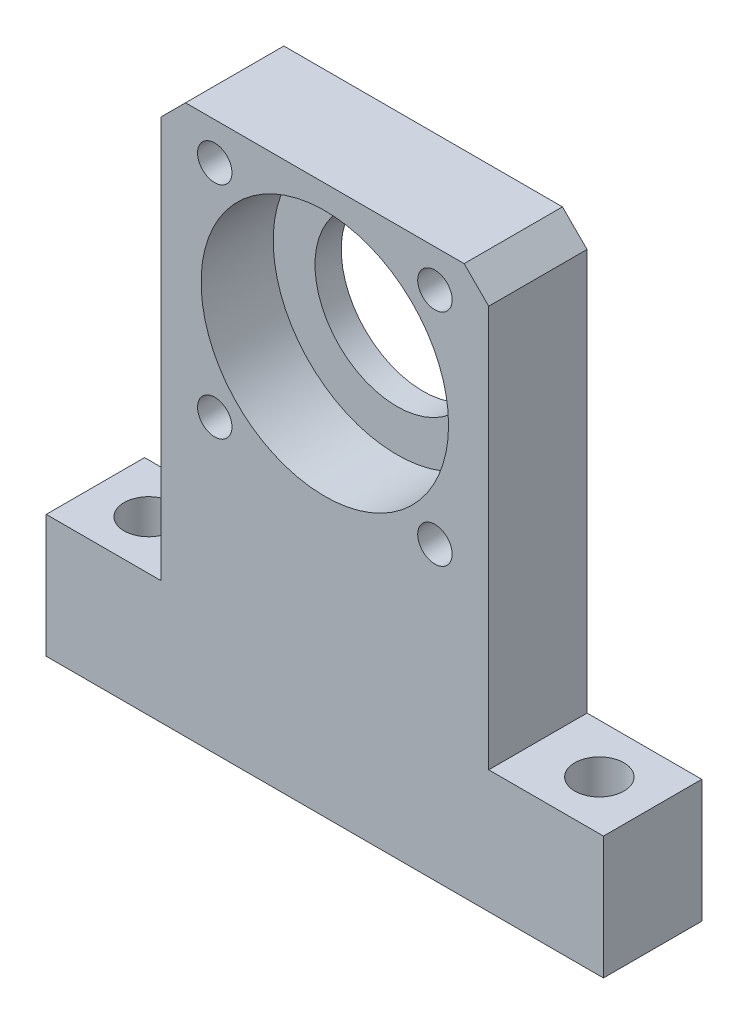
from build123d import *

# Parameters (mm, degrees)
SKETCH_1_W          = 68
SKETCH_1_H          = 67
EXTRUDE_1_DEPTH     = 12
SKETCH_2_R          = 15.1
CUT_EXTRUDE_1_DEPTH = 8.8
SKETCH_3_R          = 10
CUT_EXTRUDE_2_DEPTH = 96.866782568
HOLE_WIZARD_M5_1_D  = 4.2
SKETCH_7_W          = 14
SKETCH_7_H          = 52
CUT_EXTRUDE_3_DEPTH = 97.213304693
CHAMFER_1_SIZE      = 3
SKETCH_8_R          = 3
CUT_EXTRUDE_4_DEPTH = 97.213304693


with BuildPart() as part:
    # 草图1 → 凸台-拉伸1 (new body)
    with BuildSketch(Plane.XY):
        with Locations((34, 33.5)):
            Rectangle(SKETCH_1_W, SKETCH_1_H)
    extrude(amount=EXTRUDE_1_DEPTH)

    # 草图2 → 切除-拉伸1 (cut)
    with BuildSketch(Plane.XY.offset(12)):
        with Locations((34, 49)):
            Circle(SKETCH_2_R)
    extrude(amount=-CUT_EXTRUDE_1_DEPTH, mode=Mode.SUBTRACT)

    # 草图3 → 切除-拉伸2 (cut, through all)
    with BuildSketch(Plane.XY.offset(3.2)):
        with Locations((34, 49)):
            Circle(SKETCH_3_R)
    extrude(amount=-CUT_EXTRUDE_2_DEPTH, mode=Mode.SUBTRACT)

    # M5 螺纹孔1 (through all)
    with Locations(Plane.XY.offset(12)):
        with Locations((47.435028843, 62.435028843), (20.564971157, 62.435028843), (20.564971157, 35.564971157), (47.435028843, 35.564971157)):
            Hole(HOLE_WIZARD_M5_1_D / 2)

    # 草图7 → 切除-拉伸3 (cut, through all)
    with BuildSketch(Plane.XY.offset(12)):
        with Locations((7, 41)):
            Rectangle(SKETCH_7_W, SKETCH_7_H)
        with Locations((61, 41)):
            Rectangle(SKETCH_7_W, SKETCH_7_H)
    extrude(amount=-CUT_EXTRUDE_3_DEPTH, mode=Mode.SUBTRACT)

    # 倒角1
    chamfer_1_edges = [part.edges().sort_by_distance(p)[0] for p in [
        (14, 67, 6),
        (54, 67, 6),
    ]]
    chamfer(chamfer_1_edges, length=CHAMFER_1_SIZE)

    # 草图8 → 切除-拉伸4 (cut, through all)
    with BuildSketch(Plane.XZ):
        with Locations(Location((6.5, 6, 0), (0, 0, 270))):
            Circle(SKETCH_8_R)
        with Locations(Location((61.5, 6, 0), (0, 0, 270))):
            Circle(SKETCH_8_R)
    extrude(amount=-CUT_EXTRUDE_4_DEPTH, mode=Mode.SUBTRACT)


solid = part.part
